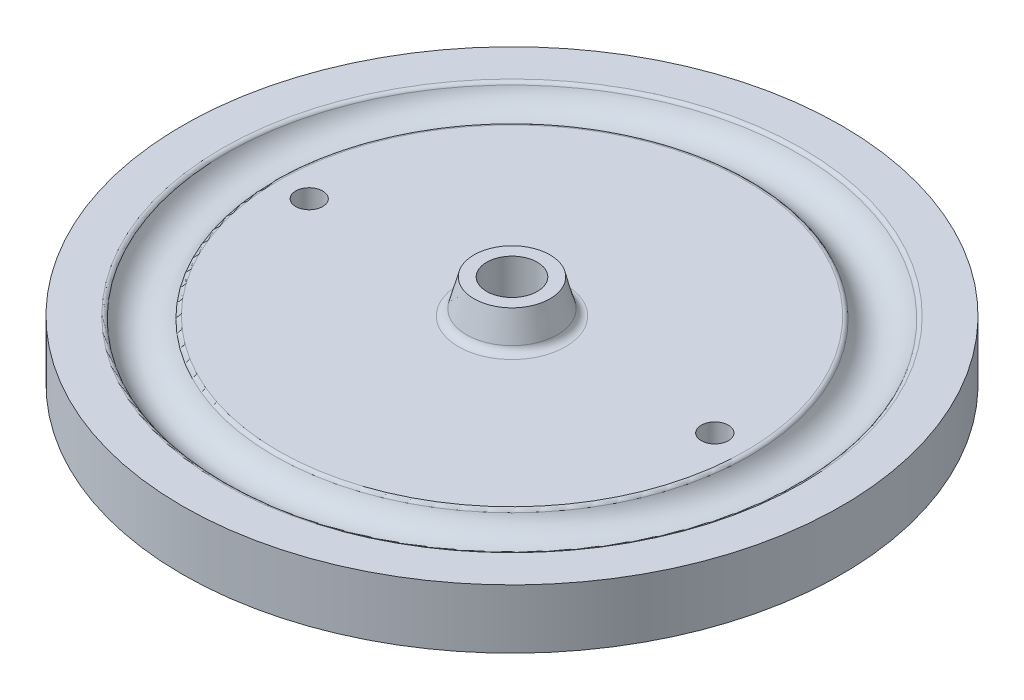
from build123d import *

# Parameters (mm, degrees)
CUT_EXTRUDE26_DEPTH            = 3
CUT_EXTRUDE27_DEPTH            = 3
F_6_0_6_DIAMETER_HOLE1_D       = 6
F_3_2_3_2_DIAMETER_HOLE1_D     = 3.2
F_3_2_3_2_DIAMETER_HOLE1_DEPTH = 8
FILLET2_R                      = 0.5
FILLET3_R                      = 1


with BuildPart() as part:
    # Sketch1 → Revolve1 (revolve)
    with BuildSketch(Plane(origin=(0, 0, 0), x_dir=(-1, 0, 0), z_dir=(0, 0, -1))):
        with BuildLine():
            Line((-39, -7), (0, -7))
            Line((0, -7), (0, 0))
            Line((0, 0), (-28.012944594, 0))
            ThreePointArc((-28.012944594, 0), (-31, -2.15), (-33.987055406, 0))
            Line((-33.987055406, 0), (-39, 0))
            Line((-39, 0), (-39, -7))
        make_face()
    revolve(axis=Axis((0, -7, 0), (0, 1, 0)))

    # Sketch27 → Cut-Extrude26 (cut)
    with BuildSketch(Plane.XZ.offset(7)):
        Polygon((26.95, -1.703183294), (26.95, 1.703183294), (24, 3.406366588), (21.05, 1.703183294), (21.05, -1.703183294), (24, -3.406366588), align=None)
    extrude(amount=-CUT_EXTRUDE26_DEPTH, mode=Mode.SUBTRACT)

    # Sketch28 → Cut-Extrude27 (cut)
    with BuildSketch(Plane.XZ.offset(7)):
        Polygon((-21.05, 1.703183294), (-24, 3.406366588), (-26.95, 1.703183294), (-26.95, -1.703183294), (-24, -3.406366588), (-21.05, -1.703183294), align=None)
    extrude(amount=-CUT_EXTRUDE27_DEPTH, mode=Mode.SUBTRACT)

    # Sketch29 → Revolve2 (revolve)
    with BuildSketch(Plane(origin=(0, 0, 0), x_dir=(-1, 0, 0), z_dir=(0, 0, -1))):
        Polygon((-5.57179677, 0), (0, 0), (0, 4), (-4.5, 4), align=None)
    revolve(axis=Axis((0, 0, 0), (0, 1, 0)))

    # Ø6.0 (6) Diameter Hole1 (through all)
    with Locations(Plane(origin=(0, 4, 0), x_dir=(1, 0, 0), z_dir=(0, 1, 0))):
        with Locations((0, 0)):
            Hole(F_6_0_6_DIAMETER_HOLE1_D / 2)

    # Ø3.2 (3.2) Diameter Hole1
    with Locations(Plane(origin=(0, -4, 0), x_dir=(-1, 0, 0), z_dir=(0, -1, 0))):
        with Locations((24, 0), (-24, 0)):
            Hole(F_3_2_3_2_DIAMETER_HOLE1_D / 2, depth=F_3_2_3_2_DIAMETER_HOLE1_DEPTH)

    # Fillet2
    fillet2_edges = [part.edges().sort_by_distance(p)[0] for p in [
        (-33.987055406, 0, 0),
        (-28.012944594, 0, 0),
    ]]
    fillet(fillet2_edges, radius=FILLET2_R)

    # Fillet3
    fillet3_edges = [part.edges().sort_by_distance(p)[0] for p in [
        (-5.57179677, 0, 0),
    ]]
    fillet(fillet3_edges, radius=FILLET3_R)


solid = part.part
